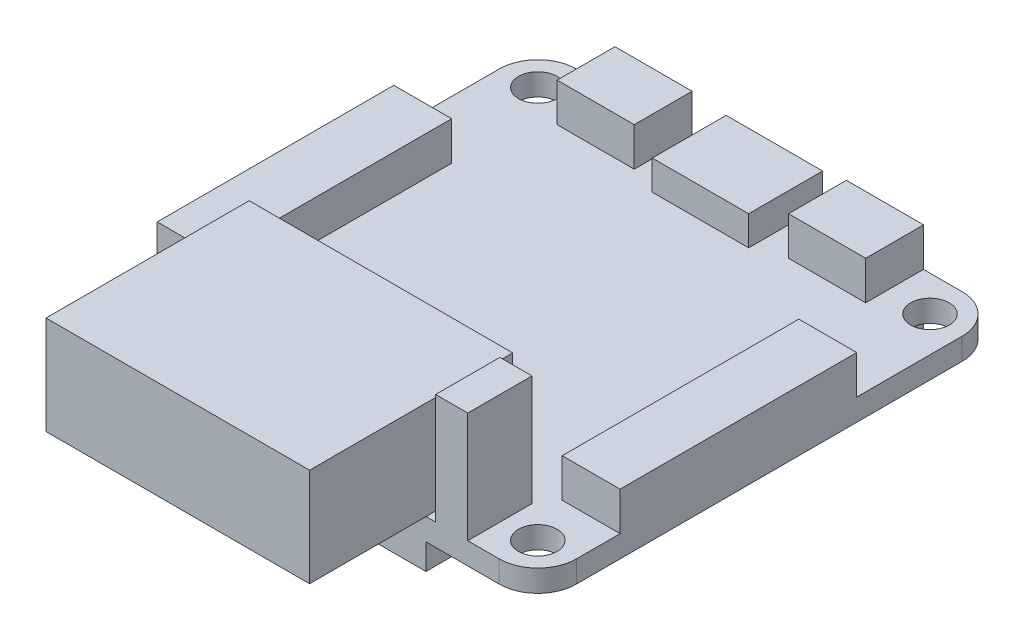
from build123d import *

# Parameters (mm, degrees)
SKETCH1_R           = 1.5
BOSS_EXTRUDE1_DEPTH = 0.85
SKETCH2_W           = 4.5
SKETCH2_H           = 18.4
BOSS_EXTRUDE2_DEPTH = 3
SKETCH3_W           = 6
SKETCH3_H           = 4.5
BOSS_EXTRUDE3_DEPTH = 3
SKETCH4_W           = 7.5
SKETCH4_H           = 5.75
BOSS_EXTRUDE4_DEPTH = 2.3
SKETCH5_W           = 20.5
SKETCH5_H           = 15.8
BOSS_EXTRUDE5_DEPTH = 7.65
SKETCH6_W           = 2.5
SKETCH6_H           = 5
BOSS_EXTRUDE6_DEPTH = 8.6
SKETCH7_W           = 20.5
SKETCH7_H           = 7
BOSS_EXTRUDE7_DEPTH = 2


with BuildPart() as part:
    # Sketch1 → Boss-Extrude1 (new, symmetric)
    with BuildSketch(Plane(origin=(0, 0, 0), x_dir=(1, 0, 0), z_dir=(0, 1, 0))):
        with BuildLine():
            Line((-15, -18), (15, -18))
            ThreePointArc((15, -18), (17.121320344, -17.121320344), (18, -15))
            Line((18, -15), (18, 15))
            ThreePointArc((18, 15), (17.121320344, 17.121320344), (15, 18))
            Line((15, 18), (-15, 18))
            ThreePointArc((-15, 18), (-17.121320344, 17.121320344), (-18, 15))
            Line((-18, 15), (-18, -15))
            ThreePointArc((-18, -15), (-17.121320344, -17.121320344), (-15, -18))
        make_face()
        with Locations(Location((-15.25, 15.25, 0), (0, 0, 270))):
            Circle(SKETCH1_R, mode=Mode.SUBTRACT)
        with Locations(Location((15.25, 15.25, 0), (0, 0, 90))):
            Circle(SKETCH1_R, mode=Mode.SUBTRACT)
        with Locations(Location((15.25, -15.25, 0), (0, 0, 270))):
            Circle(SKETCH1_R, mode=Mode.SUBTRACT)
        with Locations(Location((-15.25, -15.25, 0), (0, 0, 90))):
            Circle(SKETCH1_R, mode=Mode.SUBTRACT)
    extrude(amount=BOSS_EXTRUDE1_DEPTH, both=True)

    # Sketch2 → Boss-Extrude2 (add)
    with BuildSketch(Plane(origin=(0, 0.85, 0), x_dir=(1, 0, 0), z_dir=(0, 1, 0))):
        with Locations((-15.75, -2.4)):
            Rectangle(SKETCH2_W, SKETCH2_H)
        with Locations((15.75, -2.4)):
            Rectangle(SKETCH2_W, SKETCH2_H)
    extrude(amount=BOSS_EXTRUDE2_DEPTH)

    # Sketch3 → Boss-Extrude3 (add)
    with BuildSketch(Plane(origin=(0, 0.85, 0), x_dir=(1, 0, 0), z_dir=(0, 1, 0))):
        with Locations((-9, 15.75)):
            Rectangle(SKETCH3_W, SKETCH3_H)
        with Locations((9, 15.75)):
            Rectangle(SKETCH3_W, SKETCH3_H)
    boss_extrude3 = extrude(amount=BOSS_EXTRUDE3_DEPTH)

    # Mirror2: Boss-Extrude3 across plane
    add(boss_extrude3.mirror(Plane.ZX))

    # Sketch4 → Boss-Extrude4 (add)
    with BuildSketch(Plane(origin=(0, 0.85, 0), x_dir=(1, 0, 0), z_dir=(0, 1, 0))):
        with Locations((0, 15.525)):
            Rectangle(SKETCH4_W, SKETCH4_H)
    extrude(amount=BOSS_EXTRUDE4_DEPTH)

    # Sketch5 → Boss-Extrude5 (add)
    with BuildSketch(Plane(origin=(0, 0.85, 0), x_dir=(1, 0, 0), z_dir=(0, 1, 0))):
        with Locations((-0.95, -19.15)):
            Rectangle(SKETCH5_W, SKETCH5_H)
    extrude(amount=BOSS_EXTRUDE5_DEPTH)

    # Sketch6 → Boss-Extrude6 (add)
    with BuildSketch(Plane(origin=(0, 0.85, 0), x_dir=(1, 0, 0), z_dir=(0, 1, 0))):
        with Locations((11.3, -15.5)):
            Rectangle(SKETCH6_W, SKETCH6_H)
    extrude(amount=BOSS_EXTRUDE6_DEPTH)

    # Sketch7 → Boss-Extrude7 (add)
    with BuildSketch(Plane.XZ.offset(0.85)):
        with Locations((-0.95, 14.5)):
            Rectangle(SKETCH7_W, SKETCH7_H)
    extrude(amount=BOSS_EXTRUDE7_DEPTH)


solid = part.part
